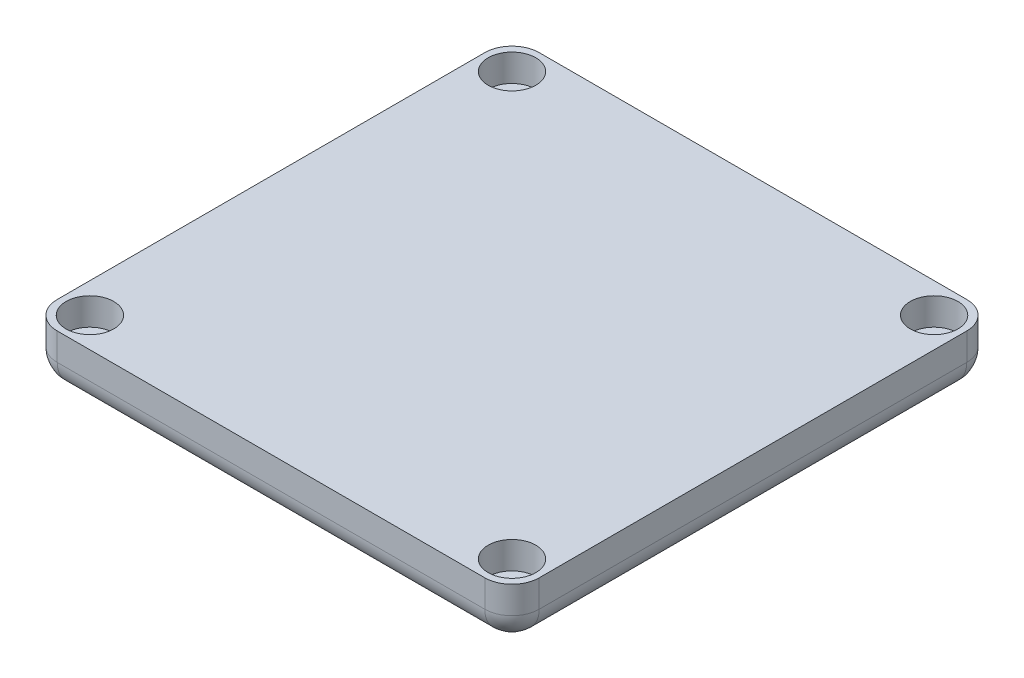
from build123d import *

# Parameters (mm, degrees)
ESQUISSE1_W             = 35.4
ESQUISSE1_H             = 35.4
BOSS_EXTRU_1_DEPTH      = 4
CONG_1_R                = 2
ESQUISSE2_R             = 1.75
ENL_V_MAT_EXTRU_1_DEPTH = 2


with BuildPart() as part:
    # Esquisse1 → Boss.-Extru.1 (new body)
    with BuildSketch(Plane(origin=(0, 0, 0), x_dir=(1, 0, 0), z_dir=(0, 1, 0))):
        Rectangle(ESQUISSE1_W, ESQUISSE1_H)
    extrude(amount=BOSS_EXTRU_1_DEPTH)

    # Congé1
    cong_1_edges = [part.edges().sort_by_distance(p)[0] for p in [
        (0, 0, 17.7),
        (-17.7, 0, 0),
        (0, 0, -17.7),
        (17.7, 0, 0),
        (17.7, 2, 17.7),
        (-17.7, 2, 17.7),
        (-17.7, 2, -17.7),
        (17.7, 2, -17.7),
    ]]
    fillet(cong_1_edges, radius=CONG_1_R)

    # Esquisse2 → Enlèv. mat.-Extru.1 (cut)
    with BuildSketch(Plane(origin=(0, 4, 0), x_dir=(1, 0, 0), z_dir=(0, 1, 0))):
        with Locations(Location((-15.5, 15.5, 0), (0, 0, 270))):
            Circle(ESQUISSE2_R)
        with Locations(Location((15.5, 15.5, 0), (0, 0, 270))):
            Circle(ESQUISSE2_R)
        with Locations(Location((15.5, -15.5, 0), (0, 0, 270))):
            Circle(ESQUISSE2_R)
        with Locations(Location((-15.5, -15.5, 0), (0, 0, 270))):
            Circle(ESQUISSE2_R)
    extrude(amount=-ENL_V_MAT_EXTRU_1_DEPTH, mode=Mode.SUBTRACT)


solid = part.part
